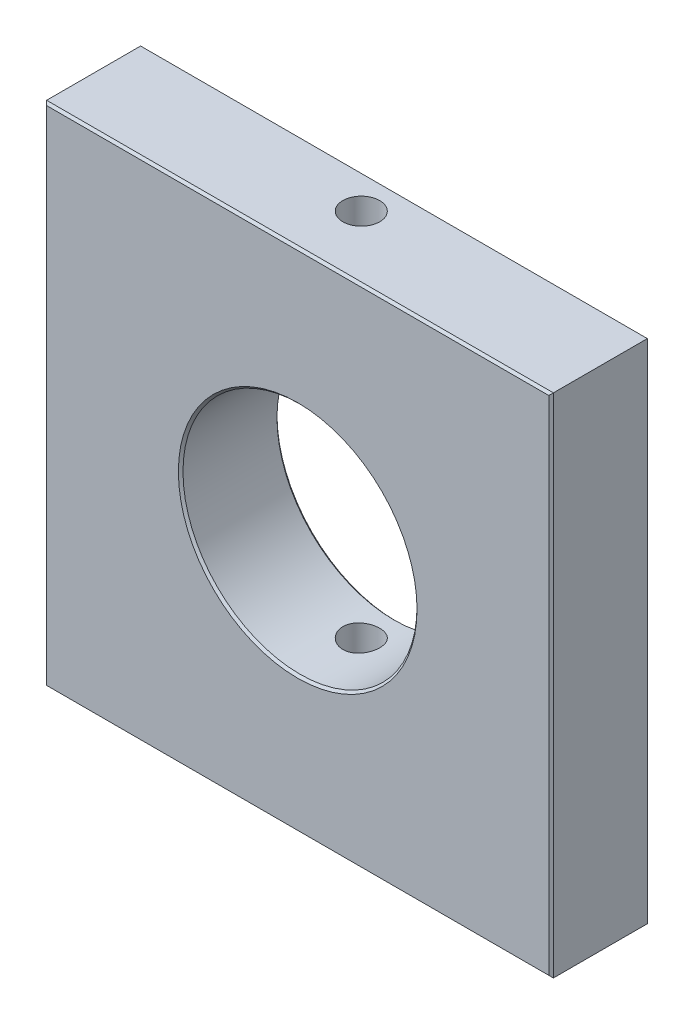
from build123d import *

# Parameters (mm, degrees)
SKETCH1_W               = 55
SKETCH1_H               = 55
SKETCH1_R               = 12.7
BOSS_EXTRUDE1_DEPTH     = 10.7
CUT_EXTRUDE1_DEPTH      = 41.335964102
CUT_EXTRUDE1_DEPTH_BACK = 41.335964102
SKETCH2_R               = 2
CHAMFER1_SIZE           = 0.25


with BuildPart() as part:
    # Sketch1 → Boss-Extrude1 (new body)
    with BuildSketch(Plane.XY):
        Rectangle(SKETCH1_W, SKETCH1_H)
        Circle(SKETCH1_R, mode=Mode.SUBTRACT)
    extrude(amount=BOSS_EXTRUDE1_DEPTH)

    # Sketch2 → Cut-Extrude1 (cut, two sides: drawn at the far end of the back side and taken through both)
    with BuildSketch(Plane(origin=(0, 0, 0), x_dir=(1, 0, 0), z_dir=(0, 1, 0)).offset(-CUT_EXTRUDE1_DEPTH_BACK)):
        with Locations(Location((0, -3.8, 0), (0, 0, 270))):
            Circle(SKETCH2_R)
    extrude(amount=CUT_EXTRUDE1_DEPTH + CUT_EXTRUDE1_DEPTH_BACK, mode=Mode.SUBTRACT)

    # Chamfer1
    chamfer1_edges = [part.edges().sort_by_distance(p)[0] for p in [
        (-12.7, 0, 0),
        (-12.7, 0, 10.7),
        (-27.5, 0, 10.7),
        (0, -27.5, 10.7),
        (27.5, 0, 10.7),
        (0, -27.5, 0),
        (-27.5, 0, 0),
        (0, 27.5, 0),
        (27.5, 0, 0),
        (0, 27.5, 10.7),
    ]]
    chamfer(chamfer1_edges, length=CHAMFER1_SIZE)


solid = part.part
